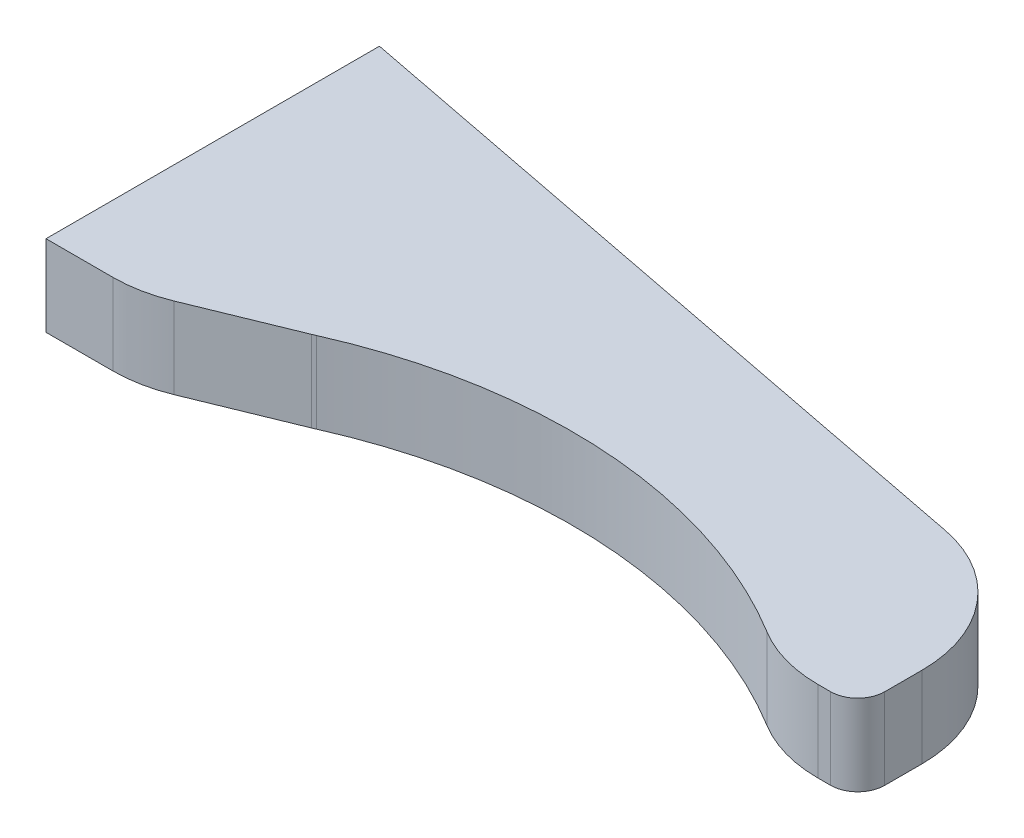
from build123d import *

# Parameters (mm, degrees)
SKETCH1_W           = 40
SKETCH1_H           = 13
BOSS_EXTRUDE1_DEPTH = 3
SKETCH3_R           = 1.25
CUT_EXTRUDE2_DEPTH  = 22.242645786
CUT_EXTRUDE3_DEPTH  = 10
FILLET2_R           = 5
FILLET3_R           = 1
FILLET4_R           = 5
FILLET5_R           = 5
SKETCH6_W           = 15.217676948
SKETCH6_H           = 27.138085695
CUT_EXTRUDE5_DEPTH  = 10


with BuildPart() as part:
    # Sketch1 → Boss-Extrude1 (new body)
    with BuildSketch(Plane(origin=(0, 0, 0), x_dir=(1, 0, 0), z_dir=(0, 1, 0))):
        Rectangle(SKETCH1_W, SKETCH1_H)
    extrude(amount=BOSS_EXTRUDE1_DEPTH)

    # Sketch3 → Cut-Extrude2 (cut, through all)
    with BuildSketch(Plane(origin=(0, 3, 0), x_dir=(1, 0, 0), z_dir=(0, 1, 0))):
        with Locations(Location((-17, 4, 0), (0, 0, 270))):
            Circle(SKETCH3_R)
        with Locations(Location((-17, -4, 0), (0, 0, 270))):
            Circle(SKETCH3_R)
    extrude(amount=-CUT_EXTRUDE2_DEPTH, mode=Mode.SUBTRACT)

    # Sketch5 → Cut-Extrude3 (cut)
    with BuildSketch(Plane(origin=(0, 3, 0), x_dir=(1, 0, 0), z_dir=(0, 1, 0))):
        with BuildLine():
            Line((-13.458222524, 6.5), (20, 0))
            Line((20, 0), (20, -6.5))
            Line((20, -6.5), (17.030073052, -6.5))
            ThreePointArc((17.030073052, -6.5), (7.775356774, -3.039372162), (-1.977274399, -4.624270773))
            Line((-1.977274399, -4.624270773), (-6.569653649, -6.5))
            Line((-6.569653649, -6.5), (-13.458222524, -6.5))
            Line((-13.458222524, -6.5), (-13.458222524, -10.237178745))
            Line((-13.458222524, -10.237178745), (26.023482417, -9.726914384))
            Line((26.023482417, -9.726914384), (26.023482417, 8.477274399))
            Line((26.023482417, 8.477274399), (-13.458222524, 8.477274399))
            Line((-13.458222524, 8.477274399), (-13.458222524, 6.5))
        make_face()
    extrude(amount=-CUT_EXTRUDE3_DEPTH, mode=Mode.SUBTRACT)

    # Fillet2
    fillet2_edges = [part.edges().sort_by_distance(p)[0] for p in [
        (-6.569653649, 1.5, 6.5),
        (-1.977274399, 1.5, 4.624270773),
        (17.030073052, 1.5, 6.5),
    ]]
    fillet(fillet2_edges, radius=FILLET2_R)

    # Fillet3
    fillet3_edges = [part.edges().sort_by_distance(p)[0] for p in [
        (20, 1.5, 6.5),
    ]]
    fillet(fillet3_edges, radius=FILLET3_R)

    # Fillet4
    fillet4_edges = [part.edges().sort_by_distance(p)[0] for p in [
        (20, 1.5, 0),
    ]]
    fillet(fillet4_edges, radius=FILLET4_R)

    # Fillet5
    fillet5_edges = [part.edges().sort_by_distance(p)[0] for p in [
        (-13.458222524, 1.5, -6.5),
    ]]
    fillet(fillet5_edges, radius=FILLET5_R)

    # Sketch6 → Cut-Extrude5 (cut)
    with BuildSketch(Plane(origin=(0, 3, 0), x_dir=(1, 0, 0), z_dir=(0, 1, 0))):
        with Locations((-17.629495701, -0.689660295)):
            Rectangle(SKETCH6_W, SKETCH6_H)
    extrude(amount=-CUT_EXTRUDE5_DEPTH, mode=Mode.SUBTRACT)


solid = part.part
